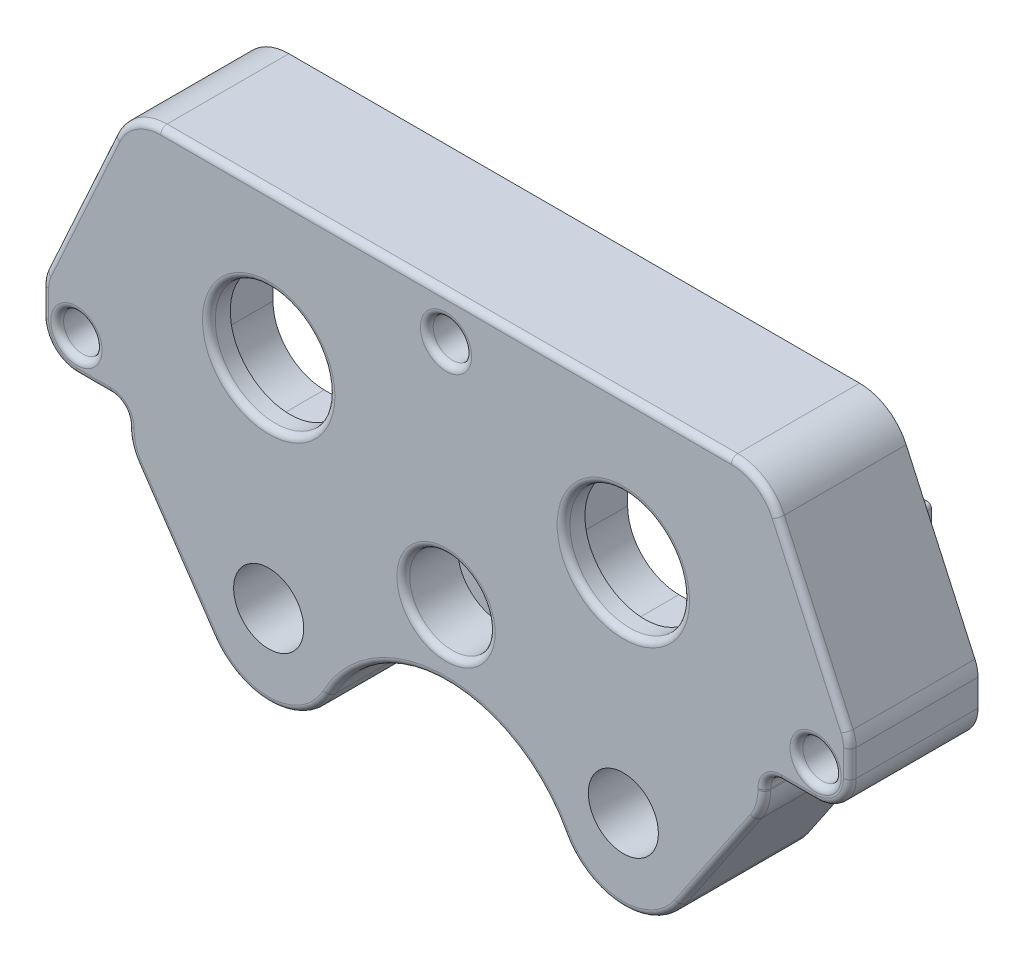
from build123d import *

# Parameters (mm, degrees)
SKETCH5_R           = 7
SKETCH5_R_2         = 5
SKETCH5_R_3         = 2.25
SKETCH5_R_4         = 4.1
BOSS_EXTRUDE5_DEPTH = 15
CUT_EXTRUDE1_START  = -2.5
SKETCH1_W           = 29
SKETCH1_H           = 30
SKETCH1_R           = 7
CUT_EXTRUDE1_DEPTH  = 12.5
CUT_EXTRUDE2_START  = -13
SKETCH5_3_R         = 6.75
SKETCH5_3_R_2       = 4.1
CUT_EXTRUDE2_DEPTH  = 2
FILLET1_R           = 6
FILLET2_R           = 4
FILLET3_R           = 6
FILLET4_R           = 2
BOSS_EXTRUDE6_START = -6.35
SKETCH5_4_R         = 5
BOSS_EXTRUDE6_DEPTH = 8.65
FILLET5_R           = 0.75
SKETCH7_W           = 8.3
SKETCH7_H           = 10
SKETCH7_W_2         = 2
BOSS_EXTRUDE7_DEPTH = 2
FILLET6_R           = 0.5


with BuildPart() as part:
    # Sketch5 → Boss-Extrude5 (new body)
    with BuildSketch(Plane.XY):
        with BuildLine():
            Line((58, 17), (-16.5, 17))
            Line((-16.5, 17), (-26.5, -5))
            Line((-26.5, -5), (-26.5, -13))
            Line((-26.5, -13), (-16.5, -13))
            Line((-16.5, -13), (-16.5, -17))
            Line((-16.5, -17), (-6.624344746, -31.585315674))
            ThreePointArc((-6.624344746, -31.585315674), (0.420970348, -35.08891632), (7.059051341, -30.864278705))
            ThreePointArc((7.059051341, -30.864278705), (20.750000185, -22.649146733), (34.440948834, -30.864279032))
            ThreePointArc((34.440948834, -30.864279032), (41.079029838, -35.08891633), (48.124344746, -31.585315674))
            Line((48.124344746, -31.585315674), (58, -17))
            Line((58, -17), (58, -13))
            Line((58, -13), (68, -13))
            Line((68, -13), (68, -5))
            Line((68, -5), (58, 17))
        make_face()
        Circle(SKETCH5_R, mode=Mode.SUBTRACT)
        with Locations((20.75, -14.649146733)):
            Circle(SKETCH5_R_2, mode=Mode.SUBTRACT)
        with Locations((41.5, 0)):
            Circle(SKETCH5_R, mode=Mode.SUBTRACT)
        with Locations((20.75, 12)):
            Circle(SKETCH5_R_3, mode=Mode.SUBTRACT)
        with Locations((-22.5, -9)):
            Circle(SKETCH5_R_3, mode=Mode.SUBTRACT)
        with Locations((64, -9)):
            Circle(SKETCH5_R_3, mode=Mode.SUBTRACT)
        with Locations((41.5, -25.4)):
            Circle(SKETCH5_R_4, mode=Mode.SUBTRACT)
        with Locations((0, -25.4)):
            Circle(SKETCH5_R_4, mode=Mode.SUBTRACT)
    extrude(amount=-BOSS_EXTRUDE5_DEPTH)

    # Sketch1 → Cut-Extrude1 (cut)
    # profile 1 of 2: a face of its own
    with BuildSketch(Plane.XY.offset(CUT_EXTRUDE1_START)):
        Rectangle(SKETCH1_W, SKETCH1_H)
        Circle(SKETCH1_R, mode=Mode.SUBTRACT)
    # profile 2 of 2: a face of its own
    with BuildSketch(Plane.XY.offset(CUT_EXTRUDE1_START)):
        with Locations((41.5, 0)):
            Rectangle(SKETCH1_W, SKETCH1_H)
        with Locations((41.5, 0)):
            Circle(SKETCH1_R, mode=Mode.SUBTRACT)
    extrude(amount=-CUT_EXTRUDE1_DEPTH, mode=Mode.SUBTRACT)

    # Sketch5<3> → Cut-Extrude2 (cut)
    # profile 1 of 2: a face of its own
    with BuildSketch(Plane.XY.offset(CUT_EXTRUDE2_START)):
        with Locations((41.5, -27.1)):
            Circle(SKETCH5_3_R)
        with Locations((41.5, -25.4)):
            Circle(SKETCH5_3_R_2, mode=Mode.SUBTRACT)
    # profile 2 of 2: a face of its own
    with BuildSketch(Plane.XY.offset(CUT_EXTRUDE2_START)):
        with Locations((0, -27.1)):
            Circle(SKETCH5_3_R)
        with Locations((0, -25.4)):
            Circle(SKETCH5_3_R_2, mode=Mode.SUBTRACT)
    extrude(amount=-CUT_EXTRUDE2_DEPTH, mode=Mode.SUBTRACT)

    # Fillet1
    fillet1_edges = [part.edges().sort_by_distance(p)[0] for p in [
        (-14.5, -15, -8.75),
        (14.5, -15, -8.75),
        (14.5, 15, -8.75),
        (-14.5, 15, -8.75),
        (27, -15, -8.75),
        (56, -15, -8.75),
        (56, 15, -8.75),
        (27, 15, -8.75),
    ]]
    fillet(fillet1_edges, radius=FILLET1_R)

    # Fillet2
    fillet2_edges = [part.edges().sort_by_distance(p)[0] for p in [
        (68, -13, -7.5),
        (-26.5, -13, -7.5),
        (-26.5, -5, -7.5),
        (68, -5, -7.5),
    ]]
    fillet(fillet2_edges, radius=FILLET2_R)

    # Fillet3
    fillet3_edges = [part.edges().sort_by_distance(p)[0] for p in [
        (58, -17, -7.5),
        (-16.5, -17, -7.5),
        (-16.5, 17, -7.5),
        (58, 17, -7.5),
    ]]
    fillet(fillet3_edges, radius=FILLET3_R)

    # Fillet4
    fillet4_edges = [part.edges().sort_by_distance(p)[0] for p in [
        (58, -13, -7.5),
        (-16.5, -13, -7.5),
    ]]
    fillet(fillet4_edges, radius=FILLET4_R)

    # Sketch5<4> → Boss-Extrude6 (add)
    with BuildSketch(Plane.XY.offset(BOSS_EXTRUDE6_START)):
        with Locations((20.75, -14.649146733)):
            Circle(SKETCH5_4_R)
    extrude(amount=-BOSS_EXTRUDE6_DEPTH)

    # Fillet5
    fillet5_edges = [part.edges().sort_by_distance(p)[0] for p in [
        (-22.120092576, 4.635796332, 0),
        (68, -7.433218389, 0),
        (-26.5, -7.433218389, 0),
        (66.828427125, -11.828427125, 0),
        (67.909339052, -5.019637995, 0),
        (-25.328427125, -11.828427125, 0),
        (-26.409339052, -5.019637995, 0),
        (-11.046301652, -25.054545237, 0),
        (52.546301652, -25.054545237, 0),
        (63.620092576, 4.635796332, 0),
        (20.75, 17, 0),
        (57.384834864, 16.044645973, 0),
        (-15.884834864, 16.044645973, 0),
        (57.736268445, -16.919113007, 0),
        (-16.236268445, -16.919113007, 0),
        (-20.5, -13, 0),
        (-16.5, -15.079894022, 0),
        (58, -15.079894022, 0),
        (62, -13, 0),
        (-17.085786438, -13.585786438, 0),
        (61.75, -9, 0),
        (58.585786438, -13.585786438, 0),
        (-24.75, -9, 0),
        (-7, 0, 0),
        (34.5, 0, 0),
        (15.75, -14.649146733, 0),
        (18.5, 12, 0),
        (41.079029838, -35.08891633, 0),
        (20.750000185, -22.649146733, 0),
        (0.420970348, -35.08891632, 0),
    ]]
    fillet(fillet5_edges, radius=FILLET5_R)

    # Sketch7 → Boss-Extrude7 (add)
    with BuildSketch(Plane(origin=(0, 0, -15), x_dir=(-1, 0, 0), z_dir=(0, 0, -1))):
        with Locations((-20.75, 2)):
            Rectangle(SKETCH7_W, SKETCH7_H)
        with Locations((-59.55, 2)):
            Rectangle(SKETCH7_W_2, SKETCH7_H)
        with Locations((18.05, 2)):
            Rectangle(SKETCH7_W_2, SKETCH7_H)
    extrude(amount=BOSS_EXTRUDE7_DEPTH)

    # Fillet6
    fillet6_edges = [part.edges().sort_by_distance(p)[0] for p in [
        (24.9, 2, -15),
        (24.9, 7, -16),
        (20.75, -3, -15),
        (24.9, -3, -16),
        (16.6, 2, -15),
        (16.6, -3, -16),
        (20.75, 7, -15),
        (16.6, 7, -16),
        (60.55, 2, -15),
        (60.55, 7, -16),
        (59.55, -3, -15),
        (60.55, -3, -16),
        (58.55, 2, -15),
        (58.55, -3, -16),
        (59.55, 7, -15),
        (58.55, 7, -16),
        (-17.05, 2, -15),
        (-17.05, 7, -16),
        (-18.05, -3, -15),
        (-17.05, -3, -16),
        (-19.05, 2, -15),
        (-19.05, -3, -16),
        (-18.05, 7, -15),
        (-19.05, 7, -16),
        (-17.05, 2, -17),
    ]]
    fillet(fillet6_edges, radius=FILLET6_R)


solid = part.part
